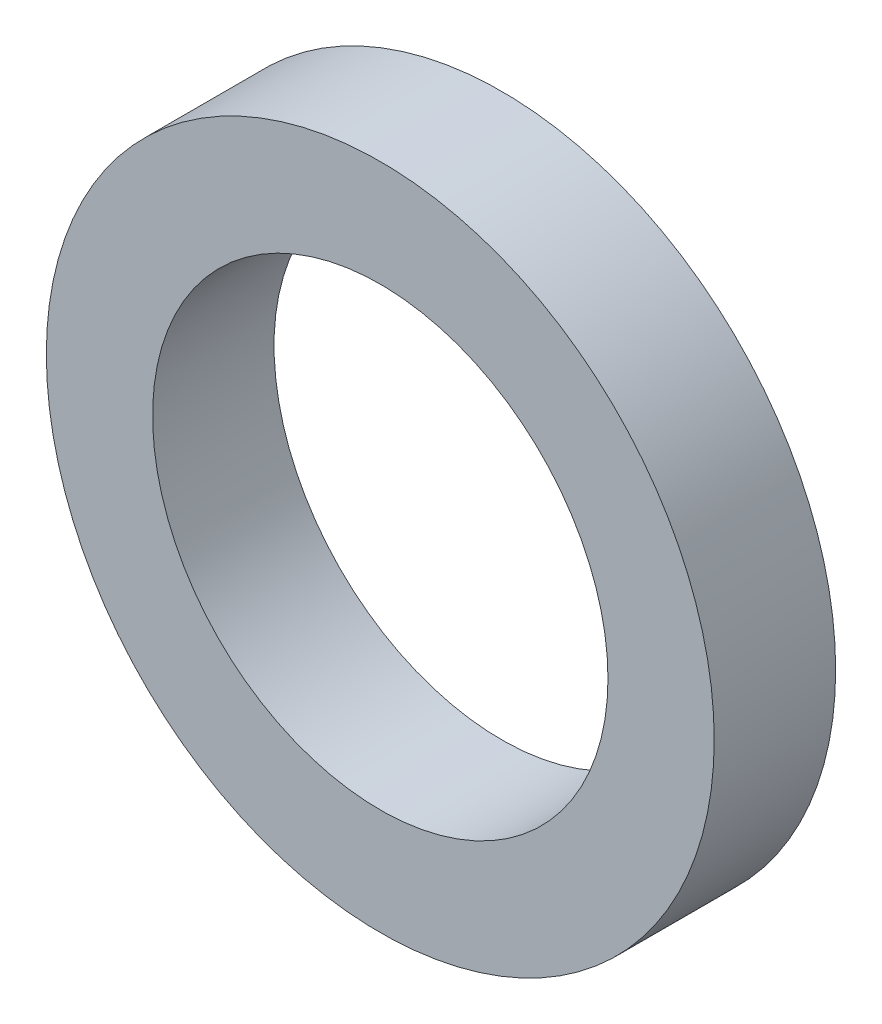
from build123d import *

# Parameters (mm, degrees)
CROQUIS1_R              = 5.5
CROQUIS1_R_2            = 3.75
SALIENTE_EXTRUIR1_DEPTH = 2


with BuildPart() as part:
    # Croquis1 → Saliente-Extruir1 (new body)
    with BuildSketch(Plane.XY):
        Circle(CROQUIS1_R)
        Circle(CROQUIS1_R_2, mode=Mode.SUBTRACT)
    extrude(amount=-SALIENTE_EXTRUIR1_DEPTH)


solid = part.part
